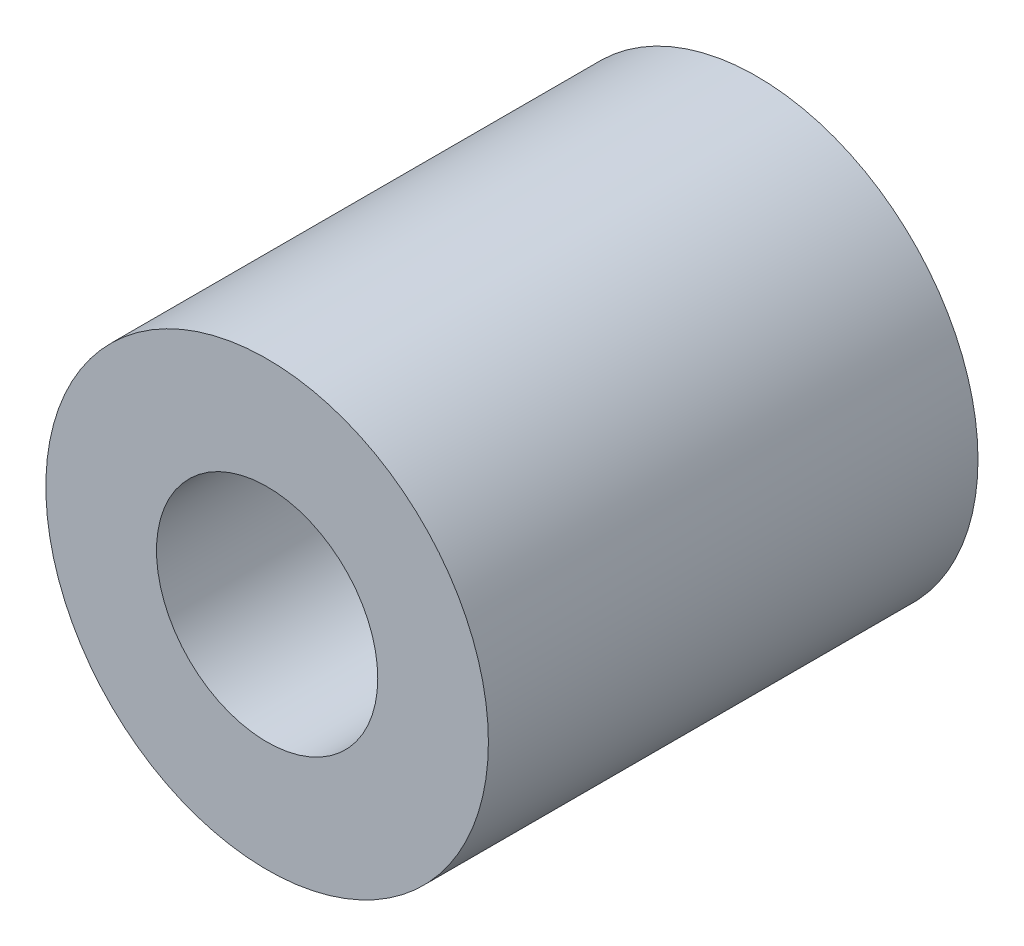
from build123d import *

# Parameters (mm, degrees)
BOSS_EXTRUDE1_DEPTH      = 7.025
BOSS_EXTRUDE1_DEPTH_BACK = 7.025
SKETCH1_R                = 6.35
SKETCH2_R                = 3.175
CUT_EXTRUDE1_DEPTH       = 17.67475637


with BuildPart() as part:
    # Sketch1 → Boss-Extrude1 (new, two sides: drawn at the far end of the back side and taken through both)
    with BuildSketch(Plane.XY.offset(-BOSS_EXTRUDE1_DEPTH_BACK)):
        Circle(SKETCH1_R)
    extrude(amount=BOSS_EXTRUDE1_DEPTH + BOSS_EXTRUDE1_DEPTH_BACK)

    # Sketch2 → Cut-Extrude1 (cut, through all)
    with BuildSketch(Plane.XY.offset(7.025)):
        Circle(SKETCH2_R)
    extrude(amount=-CUT_EXTRUDE1_DEPTH, mode=Mode.SUBTRACT)


solid = part.part
